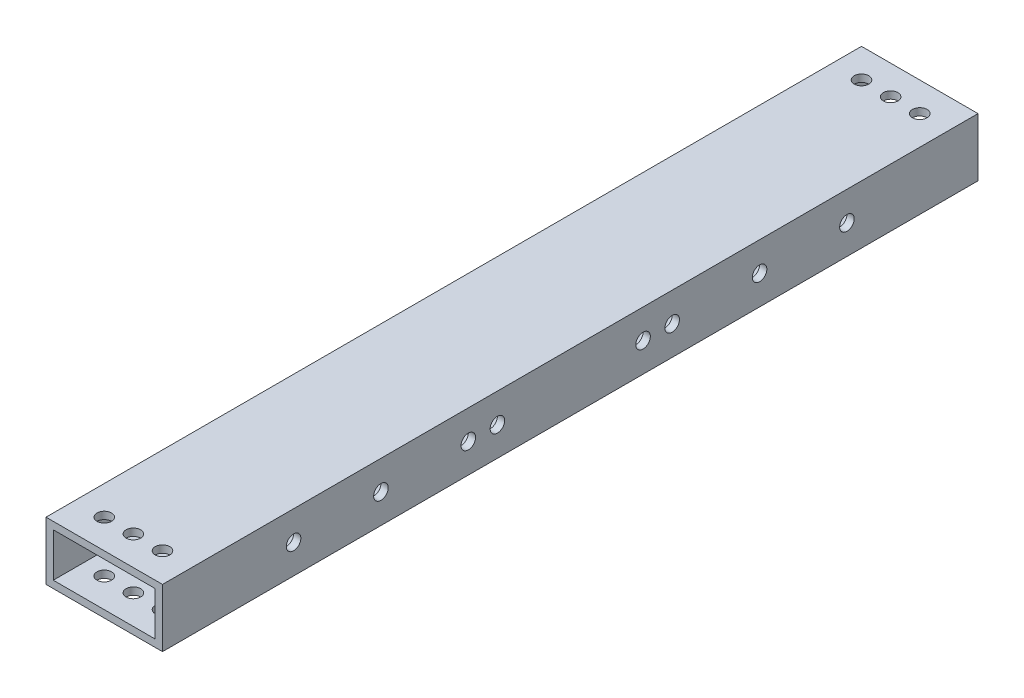
from build123d import *

# Parameters (mm, degrees)
SKETCH1_W                   = 50.8
SKETCH1_H                   = 25.4
SKETCH1_W_2                 = 44.45
SKETCH1_H_2                 = 19.05
BOSS_EXTRUDE1_DEPTH         = 355.6
CUT_EXTRUDE1_DEPTH          = 361.10715072
CUT_EXTRUDE1_DEPTH_BACK     = 361.10715072
SKETCH2_R                   = 3.175
F_1_4_0_25_DIAMETER_HOLE1_D = 6.35


with BuildPart() as part:
    # Sketch1 → Boss-Extrude1 (new body)
    with BuildSketch(Plane.XY):
        with Locations((25.4, 12.7)):
            Rectangle(SKETCH1_W, SKETCH1_H)
        with Locations((25.4, 12.7)):
            Rectangle(SKETCH1_W_2, SKETCH1_H_2, mode=Mode.SUBTRACT)
    extrude(amount=BOSS_EXTRUDE1_DEPTH)

    # Sketch2 → Cut-Extrude1 (cut, two sides: drawn at the far end of the back side and taken through both)
    with BuildSketch(Plane.ZY.offset(-CUT_EXTRUDE1_DEPTH_BACK)):
        with Locations((133.35, 12.7)):
            Circle(SKETCH2_R)
        with Locations((146.05, 12.7)):
            Circle(SKETCH2_R)
        with Locations((95.25, 12.7)):
            Circle(SKETCH2_R)
        with Locations((57.15, 12.7)):
            Circle(SKETCH2_R)
        with Locations((209.55, 12.7)):
            Circle(SKETCH2_R)
        with Locations((222.25, 12.7)):
            Circle(SKETCH2_R)
        with Locations((260.35, 12.7)):
            Circle(SKETCH2_R)
        with Locations((298.45, 12.7)):
            Circle(SKETCH2_R)
    extrude(amount=CUT_EXTRUDE1_DEPTH + CUT_EXTRUDE1_DEPTH_BACK, mode=Mode.SUBTRACT)

    # 1/4 (0.25) Diameter Hole1 (through all)
    with Locations(Plane(origin=(0, 25.4, 0), x_dir=(1, 0, 0), z_dir=(0, 1, 0))):
        with Locations((12.7, -12.7), (25.4, -12.7), (38.1, -12.7), (12.7, -342.9), (25.4, -342.9), (38.1, -342.9)):
            Hole(F_1_4_0_25_DIAMETER_HOLE1_D / 2)


solid = part.part
